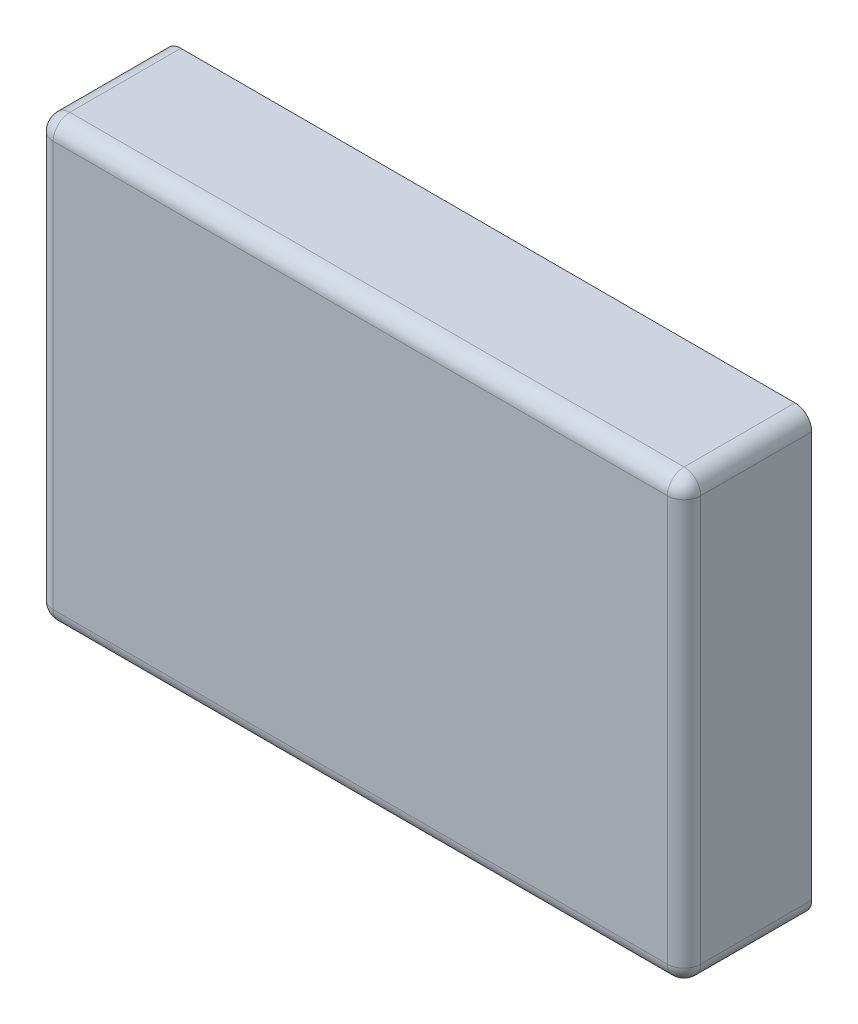
from build123d import *

# Parameters (mm, degrees)
SKETCH1_W           = 49.3522
SKETCH1_H           = 33.4518
BOSS_EXTRUDE1_DEPTH = 9.7282
FILLET1_R           = 1.27


with BuildPart() as part:
    # Sketch1 → Boss-Extrude1 (new body)
    with BuildSketch(Plane.XY):
        with Locations((24.6761, 16.7259)):
            Rectangle(SKETCH1_W, SKETCH1_H)
    extrude(amount=BOSS_EXTRUDE1_DEPTH)

    # Fillet1
    fillet1_edges = [part.edges().sort_by_distance(p)[0] for p in [
        (49.3522, 16.7259, 9.7282),
        (24.6761, 33.4518, 9.7282),
        (0, 16.7259, 9.7282),
        (24.6761, 0, 9.7282),
        (0, 33.4518, 4.8641),
        (49.3522, 33.4518, 4.8641),
        (49.3522, 0, 4.8641),
        (0, 0, 4.8641),
    ]]
    fillet(fillet1_edges, radius=FILLET1_R)


solid = part.part
